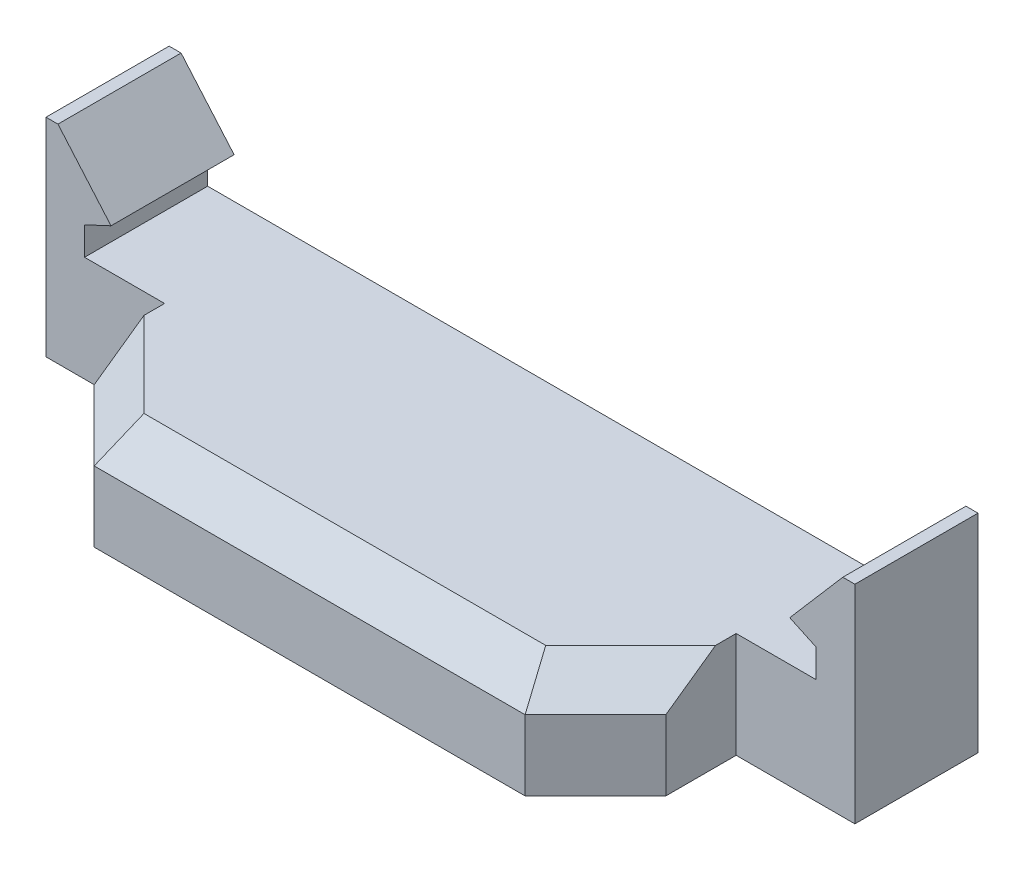
from build123d import *

# Parameters (mm, degrees)
RESSALTO_EXTRUS_O1_DEPTH = 3.5
ESBO_O3_W                = 3.5
ESBO_O3_H                = 5.900568868
CORTE_EXTRUS_O1_DEPTH    = 0.5
ESBO_O4_W                = 3.5
ESBO_O4_H                = 5.900568868
CORTE_EXTRUS_O2_DEPTH    = 0.5
ESBO_O5_W                = 16.25
ESBO_O5_H                = 3
RESSALTO_EXTRUS_O2_DEPTH = 4
CHANFRO1_SIZE            = 2
CHANFRO4_SIZE            = 1


with BuildPart() as part:
    # Esboço2 → Ressalto-extrusão1 (new body)
    with BuildSketch(Plane.XY):
        Polygon((12, 4.400568868), (11.156062048, 4.400568868), (9.648231551, 2.650555385), (10.4, 2.3), (10.4, 1.5), (-10.4, 1.5), (-10.4, 2.3), (-9.648231551, 2.650555385), (-11.156062048, 4.400568868), (-11.996, 4.400568868), (-11.996, -1.5), (12, -1.5), align=None)
    extrude(amount=RESSALTO_EXTRUS_O1_DEPTH)

    # Esboço3 → Corte-extrusão1 (cut)
    with BuildSketch(Plane(origin=(12, 0, 0), x_dir=(0, 0, -1), z_dir=(1, 0, 0))):
        with Locations((-1.75, 1.450284434)):
            Rectangle(ESBO_O3_W, ESBO_O3_H)
    extrude(amount=-CORTE_EXTRUS_O1_DEPTH, mode=Mode.SUBTRACT)

    # Esboço4 → Corte-extrusão2 (cut)
    with BuildSketch(Plane.ZY.offset(11.996)):
        with Locations((1.75, 1.450284434)):
            Rectangle(ESBO_O4_W, ESBO_O4_H)
    extrude(amount=-CORTE_EXTRUS_O2_DEPTH, mode=Mode.SUBTRACT)

    # Esboço5 → Ressalto-extrusão2 (add)
    with BuildSketch(Plane.XY.offset(3.5)):
        Rectangle(ESBO_O5_W, ESBO_O5_H)
    extrude(amount=RESSALTO_EXTRUS_O2_DEPTH)

    # Chanfro1
    chanfro1_edges = [part.edges().sort_by_distance(p)[0] for p in [
        (8.125, 0, 7.5),
        (-8.125, 0, 7.5),
    ]]
    chamfer(chanfro1_edges, length=CHANFRO1_SIZE)

    # Chanfro4
    chanfro4_edges = [part.edges().sort_by_distance(p)[0] for p in [
        (0, 1.5, 7.5),
        (7.125, 1.5, 6.5),
        (-7.125, 1.5, 6.5),
    ]]
    chamfer(chanfro4_edges, length=CHANFRO4_SIZE)


solid = part.part
